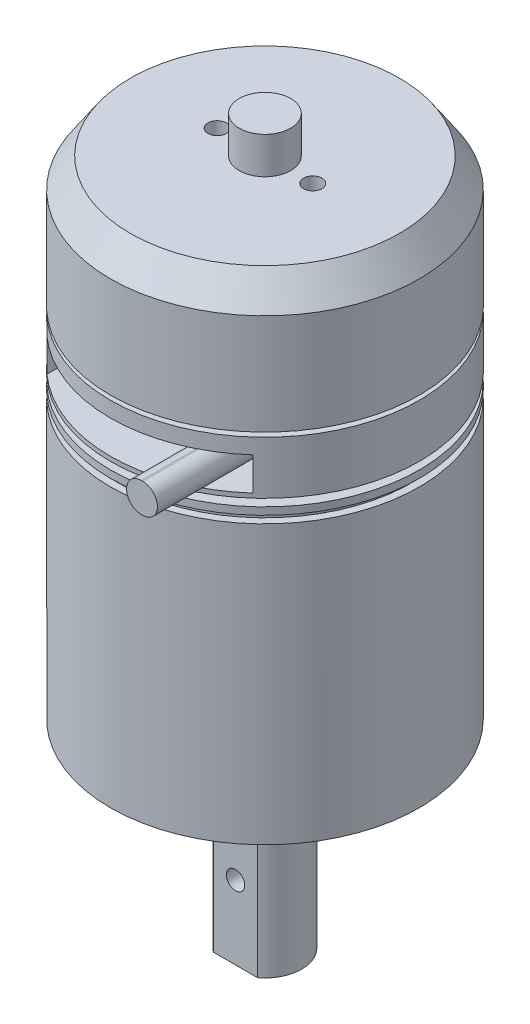
from build123d import *

# Parameters (mm, degrees)
SKETCH_2_W             = 28
SKETCH_2_H             = 4.5
CUT_EXTRUDE_1_DEPTH    = 10
EXTRUDE_1_DEPTH        = 15
HOLE_WIZARD_M3_1_D     = 2.5
HOLE_WIZARD_M3_1_DEPTH = 4
HOLE_WIZARD_M3_1_TIP   = 0.751075774
CUT_EXTRUDE_START      = -20
CUT_EXTRUDE_2_DEPTH    = 20
HOLE_WIZARD_M4_1_D     = 3.3
HOLE_WIZARD_M4_1_DEPTH = 10.1
HOLE_WIZARD_M4_1_TIP   = 0.991420021
HOLE_WIZARD_M3_2_D     = 2.5
HOLE_WIZARD_M5_1_D     = 4.2
HOLE_WIZARD_M5_1_DEPTH = 14
HOLE_WIZARD_M5_1_TIP   = 1.2618073


with BuildPart() as part:
    # 草图1 → 旋转1 (revolve)
    with BuildSketch(Plane.XY, mode=Mode.PRIVATE) as revolve_1_sk:
        Polygon((0, 0), (4.1, 0), (4.1, 6.7), (13.4, 6.7), (13.4, 8.7), (21, 8.7), (21, 10.2), (20, 10.2), (20, 11.2), (21, 11.2), (21, 12.2), (10, 12.2), (10, 13.2), (21, 13.2), (21, 20.4), (5, 20.4), (5, 21), (21, 21), (21, 34.7), (18.3, 38.7), (3.5, 38.7), (3.5, 43.7), (0, 43.7), align=None)
    revolve(revolve_1_sk.sketch.rotate(Axis((0, 43.7, 0), (0, -1, 0)), 90), axis=Axis((0, 43.7, 0), (0, -1, 0)))

    # 草图2 → 切除-拉伸1 (cut)
    with BuildSketch(Plane.XY.offset(21)):
        with Locations((0, 16.05)):
            Rectangle(SKETCH_2_W, SKETCH_2_H)
    extrude(amount=-CUT_EXTRUDE_1_DEPTH, mode=Mode.SUBTRACT)

    # 草图3 → 凸台-拉伸1 (add)
    with BuildSketch(Plane.XY.offset(11)):
        with BuildLine():
            Line((9.185056323, 18.053194417), (9.385056323, 18.053194417))
            ThreePointArc((9.385056323, 18.053194417), (11.385056323, 16.053194417), (9.385056323, 14.053194417))
            Line((9.385056323, 14.053194417), (9.185056323, 14.053194417))
            ThreePointArc((9.185056323, 14.053194417), (7.185056323, 16.053194417), (9.185056323, 18.053194417))
        make_face()
    extrude(amount=EXTRUDE_1_DEPTH)

    # M3 螺纹孔1
    with Locations(Plane(origin=(0, 38.7, 0), x_dir=(1, 0, 0), z_dir=(0, 1, 0))):
        with Locations((-6.5, 0), (6.5, 0)):
            Hole(HOLE_WIZARD_M3_1_D / 2, depth=HOLE_WIZARD_M3_1_DEPTH)
            with Locations((0, 0, -(HOLE_WIZARD_M3_1_DEPTH + HOLE_WIZARD_M3_1_TIP / 2))):  # 118° drill point
                Cone(0, HOLE_WIZARD_M3_1_D / 2, HOLE_WIZARD_M3_1_TIP, mode=Mode.SUBTRACT)

    # 草图7 → 旋转2 (revolve)
    with BuildSketch(Plane.XY, mode=Mode.PRIVATE) as revolve_2_sk:
        Polygon((0, -54.6), (5, -54.6), (5, -30.5), (8.275, -30.5), (8.275, -29.6), (13, -29.6), (13, -27.6), (21, -27.6), (21, 8.7), (0, 8.7), align=None)
    revolve(revolve_2_sk.sketch.rotate(Axis((0, 8.7, 0), (0, -1, 0)), 180), axis=Axis((0, 8.7, 0), (0, -1, 0)))

    # 草图8 → 切除-拉伸2 (cut)
    with BuildSketch(Plane.XZ.offset(54.6).offset(CUT_EXTRUDE_START)):
        with BuildLine():
            Line((-3, 4), (3, 4))
            ThreePointArc((3, 4), (0, 5), (-3, 4))
        make_face()
    extrude(amount=CUT_EXTRUDE_2_DEPTH, mode=Mode.SUBTRACT)

    # M4 螺纹孔1
    with Locations(Plane(origin=(0, -27.6, 0), x_dir=(-1, 0, 0), z_dir=(0, -1, 0))):
        with Locations((17.5, 0), (0, -17.5), (-17.5, 0), (0, 17.5)):
            Hole(HOLE_WIZARD_M4_1_D / 2, depth=HOLE_WIZARD_M4_1_DEPTH)
            with Locations((0, 0, -(HOLE_WIZARD_M4_1_DEPTH + HOLE_WIZARD_M4_1_TIP / 2))):  # 118° drill point
                Cone(0, HOLE_WIZARD_M4_1_D / 2, HOLE_WIZARD_M4_1_TIP, mode=Mode.SUBTRACT)

    # M3 螺纹孔2 (through all)
    with Locations(Plane(origin=(0, -44.6, 4), x_dir=(1, 0, 0), z_dir=(0, 0, 1))):
        with Locations((0, 0)):
            Hole(HOLE_WIZARD_M3_2_D / 2)

    # M5 螺纹孔1
    with Locations(Plane(origin=(0, -54.6, 0), x_dir=(-1, 0, 0), z_dir=(0, -1, 0))):
        with Locations((0, 0)):
            Hole(HOLE_WIZARD_M5_1_D / 2, depth=HOLE_WIZARD_M5_1_DEPTH)
            with Locations((0, 0, -(HOLE_WIZARD_M5_1_DEPTH + HOLE_WIZARD_M5_1_TIP / 2))):  # 118° drill point
                Cone(0, HOLE_WIZARD_M5_1_D / 2, HOLE_WIZARD_M5_1_TIP, mode=Mode.SUBTRACT)


solid = part.part
